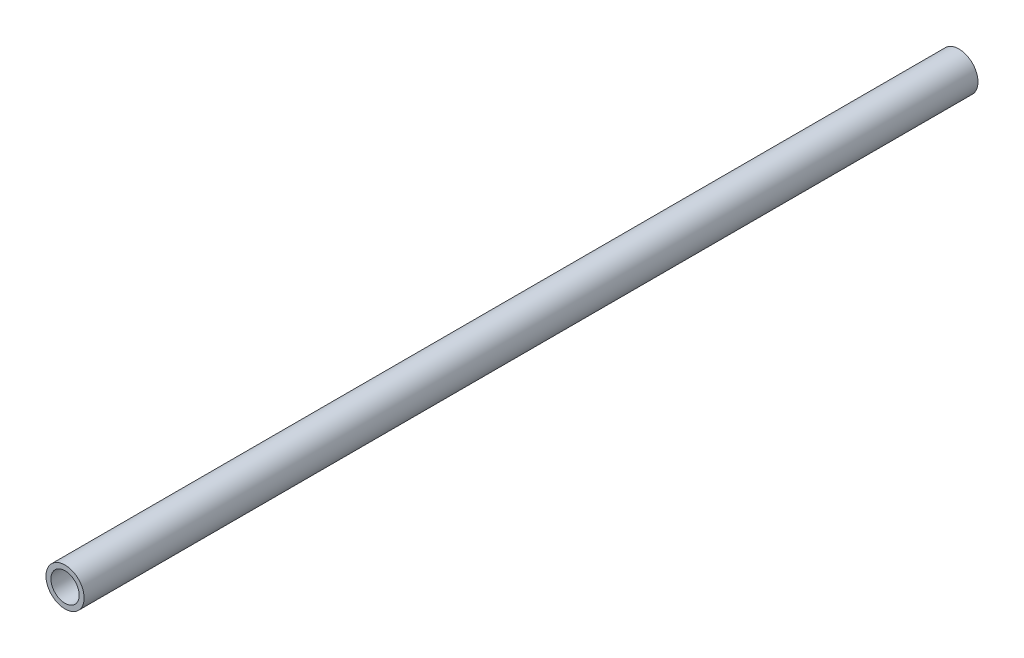
from build123d import *

# Parameters (mm, degrees)
SKETCH1_R           = 10.668
SKETCH1_R_2         = 7.8994
EXTRUDE_THIN1_DEPTH = 250


with BuildPart() as part:
    # Sketch1 → Extrude-Thin1 (new, symmetric)
    with BuildSketch(Plane.XY):
        Circle(SKETCH1_R)
        Circle(SKETCH1_R_2, mode=Mode.SUBTRACT)
    extrude(amount=EXTRUDE_THIN1_DEPTH, both=True)


solid = part.part
